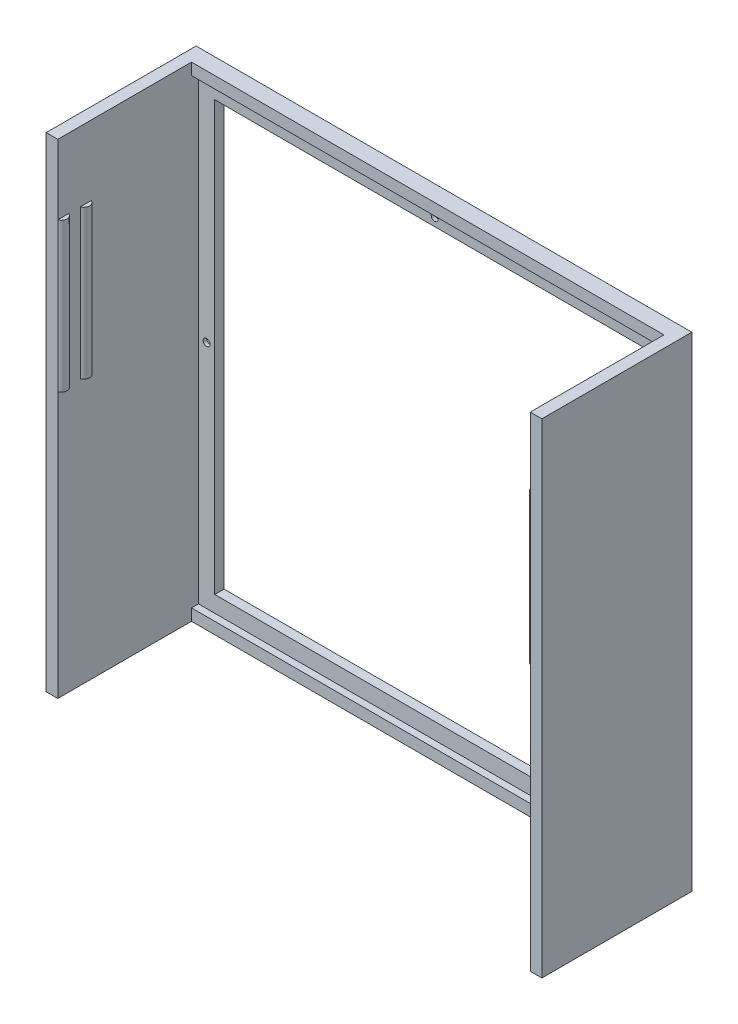
from build123d import *

# Parameters (mm, degrees)
SKETCH1_W           = 213.2
SKETCH1_H           = 208.28
SKETCH1_W_2         = 203.2
SKETCH1_H_2         = 198.28
BOSS_EXTRUDE1_DEPTH = 7
SKETCH2_W           = 203.2
SKETCH2_H           = 198.28
SKETCH2_R           = 1.5
SKETCH2_W_2         = 189.2
SKETCH2_H_2         = 184.28
BOSS_EXTRUDE2_DEPTH = 4
BOSS_EXTRUDE3_DEPTH = 57.5
BOSS_EXTRUDE4_START = -30
BOSS_EXTRUDE4_DEPTH = 64
CUT_EXTRUDE1_START  = -4
CUT_EXTRUDE1_DEPTH  = 2.5


with BuildPart() as part:
    # Sketch1 → Boss-Extrude1 (new body)
    with BuildSketch(Plane.XY):
        Rectangle(SKETCH1_W, SKETCH1_H)
        Rectangle(SKETCH1_W_2, SKETCH1_H_2, mode=Mode.SUBTRACT)
    extrude(amount=BOSS_EXTRUDE1_DEPTH)

    # Sketch2 → Boss-Extrude2 (add)
    with BuildSketch(Plane.XY):
        Rectangle(SKETCH2_W, SKETCH2_H)
        with Locations((0, 95.64)):
            Circle(SKETCH2_R, mode=Mode.SUBTRACT)
        with Locations((-98.1, 0)):
            Circle(SKETCH2_R, mode=Mode.SUBTRACT)
        with Locations(Location((98.1, 0, 0), (0, 0, 180))):
            Circle(SKETCH2_R, mode=Mode.SUBTRACT)
        Rectangle(SKETCH2_W_2, SKETCH2_H_2, mode=Mode.SUBTRACT)
    extrude(amount=BOSS_EXTRUDE2_DEPTH)

    # Sketch3 → Boss-Extrude3 (add)
    with BuildSketch(Plane.XY.offset(7)):
        Polygon((-106.6, 104.14), (-106.6, -104.14), (-101.6, -104.14), (-101.6, -99.14), (-101.6, 99.14), (-101.6, 104.14), align=None)
        Polygon((101.6, -99.14), (101.6, -104.14), (106.6, -104.14), (106.6, 104.14), (101.6, 104.14), (101.6, 99.14), align=None)
    extrude(amount=BOSS_EXTRUDE3_DEPTH)

    # Sketch4 → Boss-Extrude4 (add)
    with BuildSketch(Plane(origin=(0, 104.14, 0), x_dir=(1, 0, 0), z_dir=(0, 1, 0)).offset(BOSS_EXTRUDE4_START)):
        with BuildLine():
            Line((-101.6, -59.8), (-101.6, -64.5))
            ThreePointArc((-101.6, -64.5), (-99.952936105, -62.15), (-101.6, -59.8))
        make_face()
        with BuildLine():
            Line((101.6, -59.8), (101.6, -64.5))
            ThreePointArc((101.6, -64.5), (99.952936105, -62.15), (101.6, -59.8))
        make_face()
        with BuildLine():
            Line((-101.6, -50.1), (-101.6, -54.8))
            ThreePointArc((-101.6, -54.8), (-99.952936105, -52.45), (-101.6, -50.1))
        make_face()
        with BuildLine():
            Line((101.6, -50.1), (101.6, -54.8))
            ThreePointArc((101.6, -54.8), (99.952936105, -52.45), (101.6, -50.1))
        make_face()
    extrude(amount=-BOSS_EXTRUDE4_DEPTH)

    # Sketch5 → Cut-Extrude1 (cut)
    with BuildSketch(Plane.XY.offset(4).offset(CUT_EXTRUDE1_START)):
        Polygon((-95.325, -1.602146997), (-95.325, 1.602146997), (-98.1, 3.204293994), (-100.875, 1.602146997), (-100.875, -1.602146997), (-98.1, -3.204293994), align=None)
        Polygon((98.1, -3.204293994), (95.325, -1.602146997), (95.325, 1.602146997), (98.1, 3.204293994), (100.875, 1.602146997), (100.875, -1.602146997), align=None)
        Polygon((1.602146997, 92.865), (3.204293994, 95.64), (1.602146997, 98.415), (-1.602146997, 98.415), (-3.204293994, 95.64), (-1.602146997, 92.865), align=None)
    extrude(amount=CUT_EXTRUDE1_DEPTH, mode=Mode.SUBTRACT)


solid = part.part
